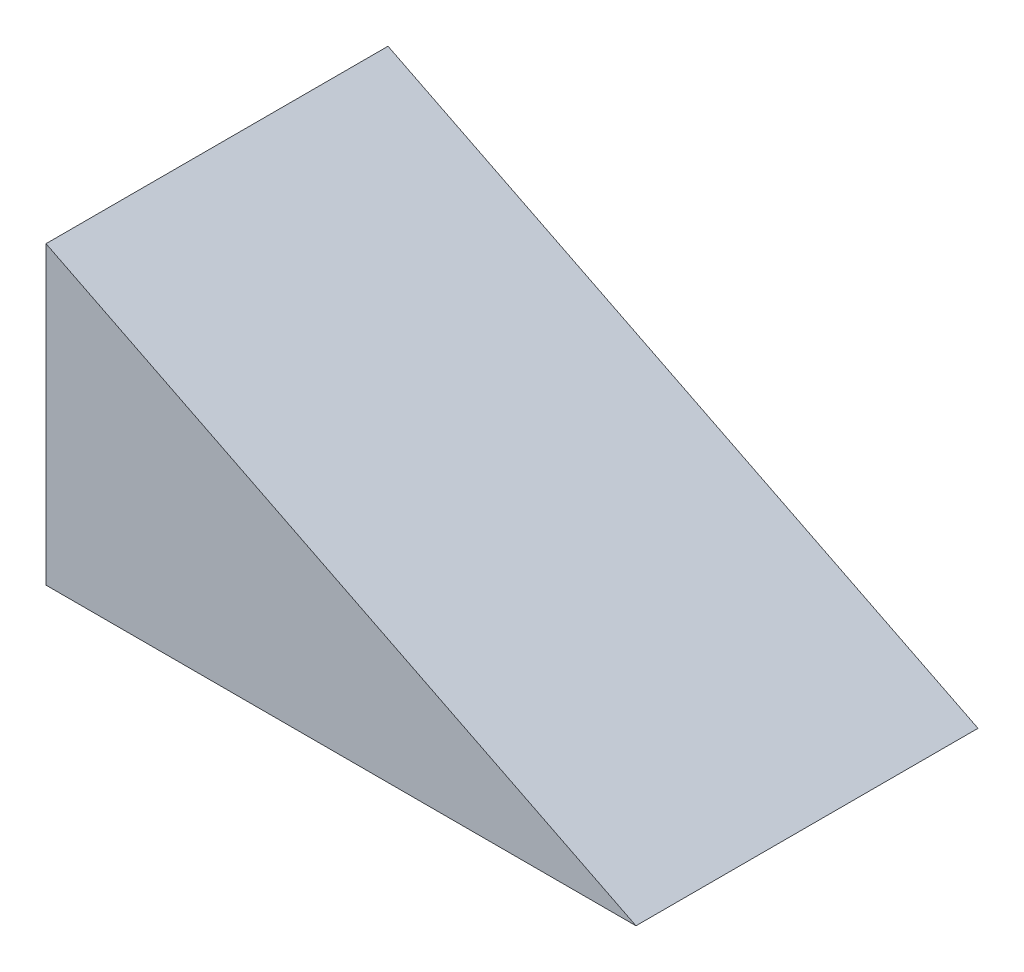
from build123d import *

# Parameters (mm, degrees)
EXTRUDE_2_DEPTH = 600


with BuildPart() as part:
    # 草图1 → 凸台-拉伸2 (new body)
    with BuildSketch(Plane.XY):
        Polygon((0, 0), (0, 518.79504679), (1035, 0), align=None)
    extrude(amount=-EXTRUDE_2_DEPTH)


solid = part.part
